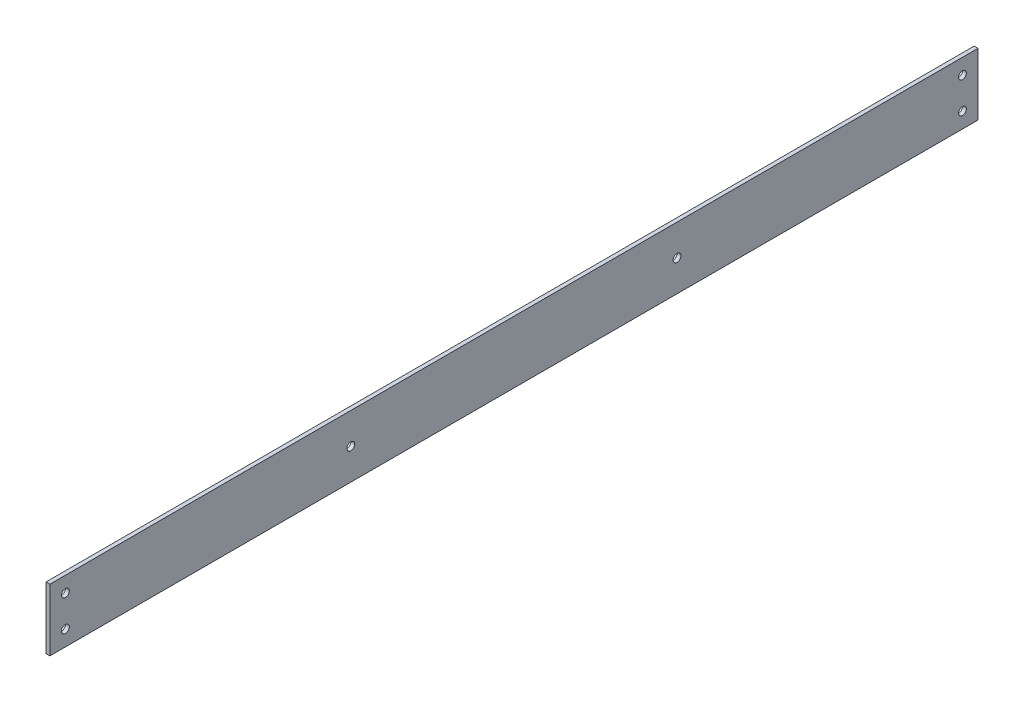
from build123d import *

# Parameters (mm, degrees)
SKETCH1_W           = 3.175
SKETCH1_H           = 50.8
BOSS_EXTRUDE1_DEPTH = 809.625
SKETCH2_R           = 3.175
CUT_EXTRUDE1_DEPTH  = 811.029555788
SKETCH3_W           = 25.4
SKETCH3_H           = 50.8
CUT_EXTRUDE2_DEPTH  = 811.029555788
SKETCH4_R           = 3.175
CUT_EXTRUDE3_DEPTH  = 785.642651944


with BuildPart() as part:
    # Sketch1 → Boss-Extrude1 (new body)
    with BuildSketch(Plane.XY):
        Rectangle(SKETCH1_W, SKETCH1_H)
    extrude(amount=BOSS_EXTRUDE1_DEPTH)

    # Sketch2 → Cut-Extrude1 (cut, through all)
    with BuildSketch(Plane(origin=(1.5875, 0, 0), x_dir=(0, 0, -1), z_dir=(1, 0, 0))):
        with Locations((-38.1, 12.7)):
            Circle(SKETCH2_R)
        with Locations((-38.1, -12.7)):
            Circle(SKETCH2_R)
        with Locations(Location((-771.525, 12.7, 0), (0, 0, 180))):
            Circle(SKETCH2_R)
        with Locations(Location((-771.525, -12.7, 0), (0, 0, 180))):
            Circle(SKETCH2_R)
    extrude(amount=-CUT_EXTRUDE1_DEPTH, mode=Mode.SUBTRACT)

    # Sketch3 → Cut-Extrude2 (cut, through all)
    with BuildSketch(Plane.ZY.offset(1.5875)):
        with Locations((796.925, 0)):
            Rectangle(SKETCH3_W, SKETCH3_H)
        with Locations((12.7, 0)):
            Rectangle(SKETCH3_W, SKETCH3_H)
    extrude(amount=-CUT_EXTRUDE2_DEPTH, mode=Mode.SUBTRACT)

    # Sketch4 → Cut-Extrude3 (cut, through all)
    with BuildSketch(Plane.ZY.offset(1.5875)):
        with Locations((271.4625, 0)):
            Circle(SKETCH4_R)
        with Locations((538.1625, 0)):
            Circle(SKETCH4_R)
    extrude(amount=-CUT_EXTRUDE3_DEPTH, mode=Mode.SUBTRACT)


solid = part.part
